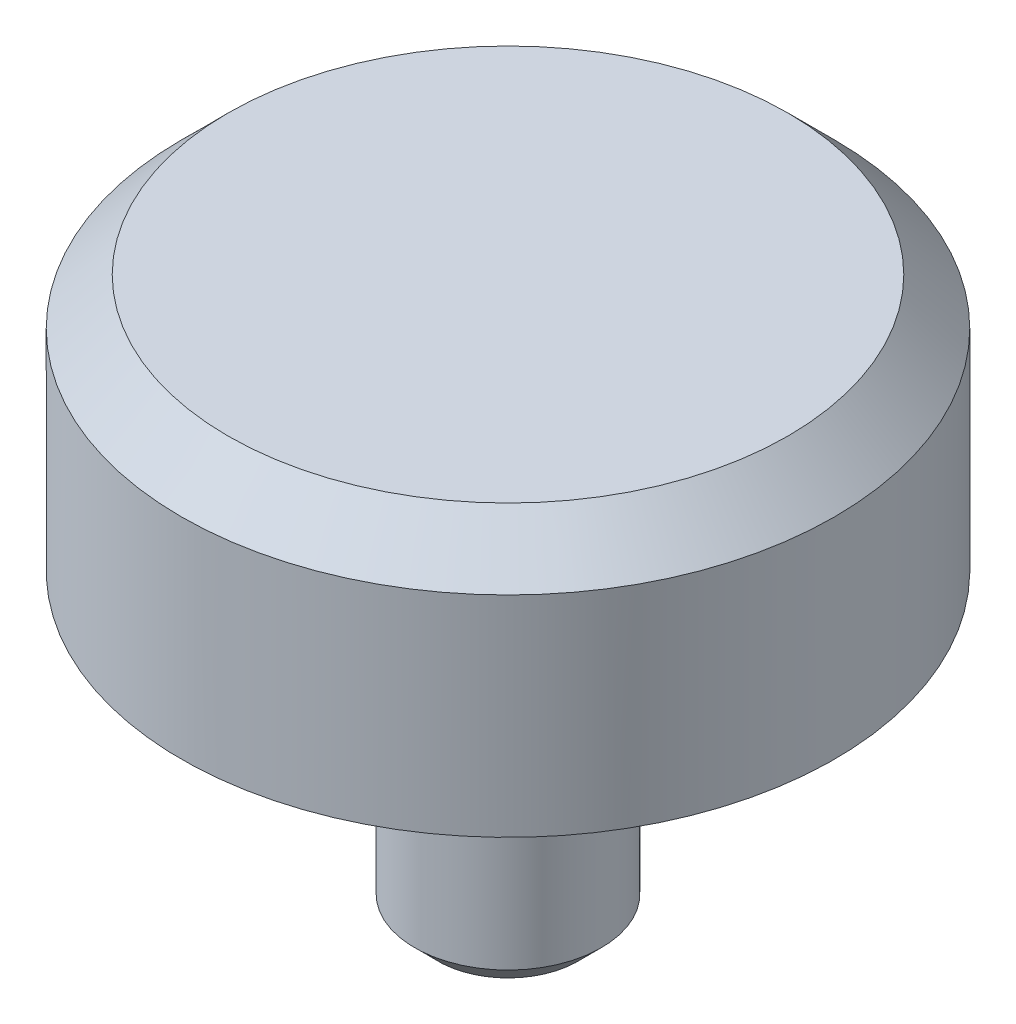
from build123d import *

# Parameters (mm, degrees)
FILLET1_R     = 1
CHAMFER1_SIZE = 2
CHAMFER2_SIZE = 1


with BuildPart() as part:
    # Sketch1 → Revolve1 (revolve)
    with BuildSketch(Plane.XY, mode=Mode.PRIVATE) as revolve1_sk:
        Polygon((0, 0), (0, 24), (14, 24), (14, 13), (4, 13), (4, 0), align=None)
    revolve(revolve1_sk.sketch.rotate(Axis((0, 0, 0), (0, 1, 0)), 90), axis=Axis((0, 0, 0), (0, 1, 0)))

    # Fillet1
    fillet1_edges = [part.edges().sort_by_distance(p)[0] for p in [
        (0, 13, 4),
    ]]
    fillet(fillet1_edges, radius=FILLET1_R)

    # Chamfer1
    chamfer1_edges = [part.edges().sort_by_distance(p)[0] for p in [
        (0, 24, 14),
    ]]
    chamfer(chamfer1_edges, length=CHAMFER1_SIZE)

    # Chamfer2
    chamfer2_edges = [part.edges().sort_by_distance(p)[0] for p in [
        (0, 0, 4),
    ]]
    chamfer(chamfer2_edges, length=CHAMFER2_SIZE)


solid = part.part
